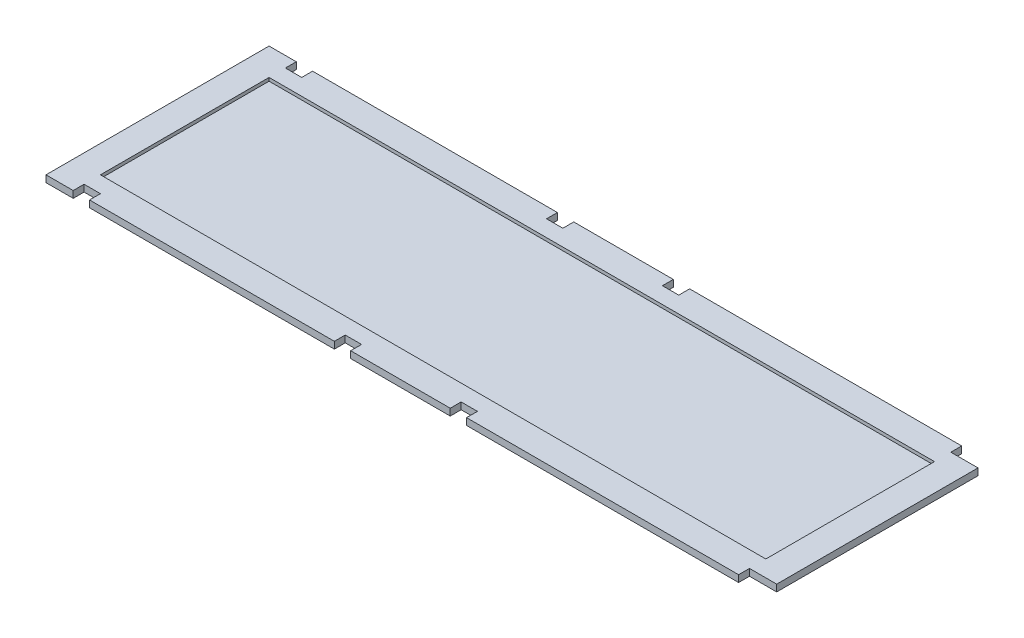
from build123d import *

# Parameters (mm, degrees)
BOSS_EXTRUDE1_DEPTH = 1.25
SKETCH2_W           = 122.3
SKETCH2_H           = 31
CUT_EXTRUDE1_DEPTH  = 0.6


with BuildPart() as part:
    # Sketch1 → Boss-Extrude1 (new body)
    with BuildSketch(Plane(origin=(0, 0, 0), x_dir=(1, 0, 0), z_dir=(0, 1, 0))):
        Polygon((8, 0), (53, 0), (53, 2), (56, 2), (56, 0), (74.3, 0), (74.3, 2), (77.3, 2), (77.3, 0), (127.3, 0), (127.3, 2), (132.3, 2), (132.3, 39), (127.3, 39), (127.3, 41), (77.3, 41), (77.3, 39), (74.3, 39), (74.3, 41), (56, 41), (56, 39), (53, 39), (53, 41), (8, 41), (8, 39), (5, 39), (5, 41), (0, 41), (0, 0), (5, 0), (5, 2), (8, 2), align=None)
    extrude(amount=BOSS_EXTRUDE1_DEPTH)

    # Sketch2 → Cut-Extrude1 (cut)
    with BuildSketch(Plane(origin=(0, 1.25, 0), x_dir=(1, 0, 0), z_dir=(0, 1, 0))):
        with Locations((66.15, 20.5)):
            Rectangle(SKETCH2_W, SKETCH2_H)
    extrude(amount=-CUT_EXTRUDE1_DEPTH, mode=Mode.SUBTRACT)


solid = part.part
